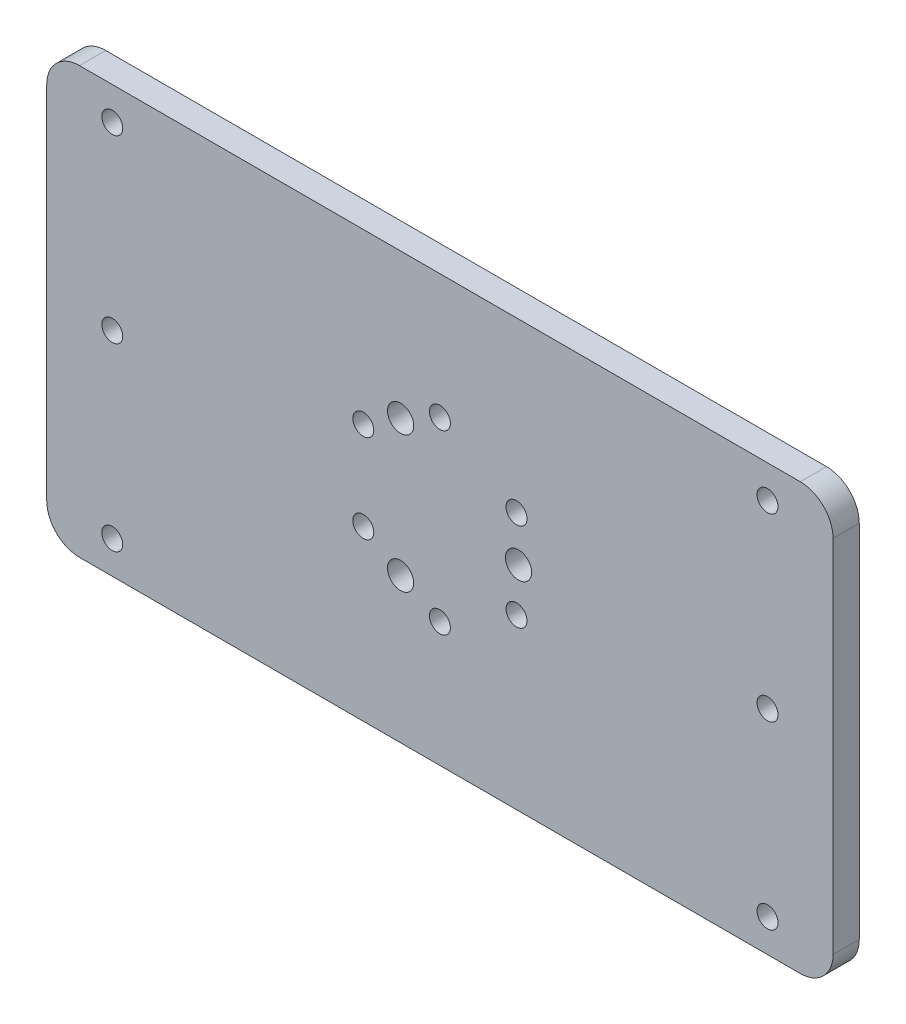
from build123d import *

# Parameters (mm, degrees)
SKETCH_1_W          = 120
SKETCH_1_H          = 65
EXTRUDE_1_DEPTH     = 4
SKETCH_2_R          = 1.6
CUT_EXTRUDE_1_DEPTH = 137.53204752
FILLET_1_R          = 5
SKETCH_4_R          = 2
SKETCH_4_R_2        = 1.6
CUT_EXTRUDE_3_DEPTH = 12.5


with BuildPart() as part:
    # 草图1 → 凸台-拉伸1 (new body)
    with BuildSketch(Plane.XY):
        with Locations((60, -32.5)):
            Rectangle(SKETCH_1_W, SKETCH_1_H)
    extrude(amount=EXTRUDE_1_DEPTH)

    # 草图2 → 切除-拉伸1 (cut, through all)
    with BuildSketch(Plane.XY.offset(4)):
        with Locations((10, -5)):
            Circle(SKETCH_2_R)
        with Locations((10, -32.5)):
            Circle(SKETCH_2_R)
        with Locations((10, -60)):
            Circle(SKETCH_2_R)
        with Locations(Location((110, -60, 0), (0, 0, 180))):
            Circle(SKETCH_2_R)
        with Locations(Location((110, -32.5, 0), (0, 0, 180))):
            Circle(SKETCH_2_R)
        with Locations(Location((110, -5, 0), (0, 0, 180))):
            Circle(SKETCH_2_R)
    extrude(amount=-CUT_EXTRUDE_1_DEPTH, mode=Mode.SUBTRACT)

    # 圆角1
    fillet_1_edges = [part.edges().sort_by_distance(p)[0] for p in [
        (0, 0, 2),
        (120, 0, 2),
        (120, -65, 2),
        (0, -65, 2),
    ]]
    fillet(fillet_1_edges, radius=FILLET_1_R)

    # 草图4 → 切除-拉伸3 (cut)
    with BuildSketch(Plane.XY.offset(4)):
        with Locations((72, -32.5)):
            Circle(SKETCH_4_R)
        with Locations((60, -19)):
            Circle(SKETCH_4_R_2)
        with Locations((71.691342951, -25.75)):
            Circle(SKETCH_4_R_2)
        with Locations((71.691342951, -39.25)):
            Circle(SKETCH_4_R_2)
        with Locations((60, -46)):
            Circle(SKETCH_4_R_2)
        with Locations((48.308657049, -39.25)):
            Circle(SKETCH_4_R_2)
        with Locations((48.308657049, -25.75)):
            Circle(SKETCH_4_R_2)
        with Locations((54, -42.892304845)):
            Circle(SKETCH_4_R)
        with Locations((54, -22.107695155)):
            Circle(SKETCH_4_R)
    extrude(amount=-CUT_EXTRUDE_3_DEPTH, mode=Mode.SUBTRACT)


solid = part.part
